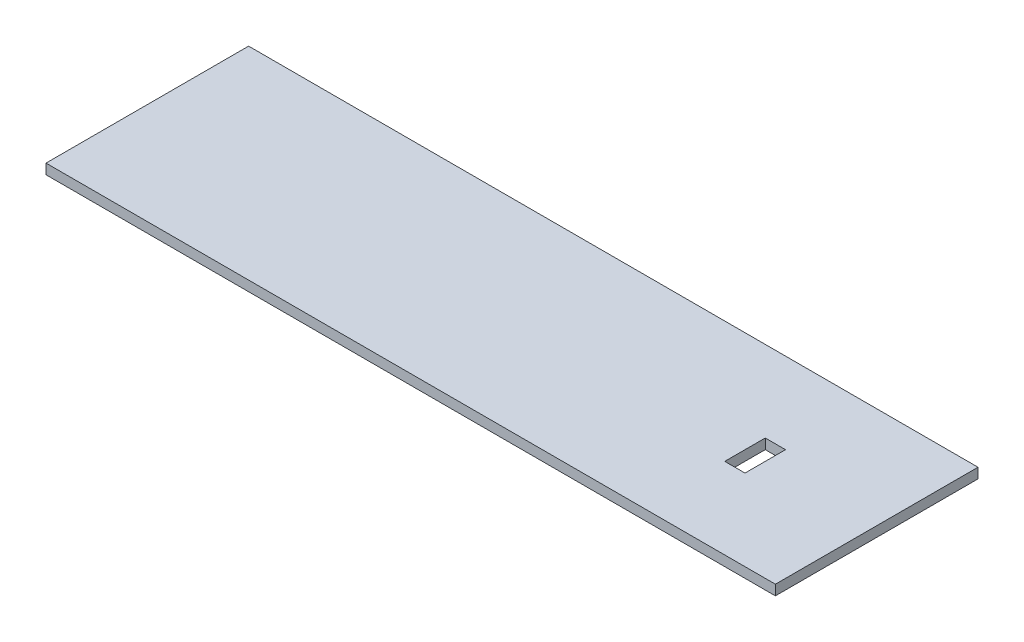
from build123d import *

# Parameters (mm, degrees)
CROQUIS1_W              = 720
CROQUIS1_H              = 200
SALIENTE_EXTRUIR1_DEPTH = 10
CROQUIS2_W              = 20
CROQUIS2_H              = 40
CORTAR_EXTRUIR1_DEPTH   = 10


with BuildPart() as part:
    # Croquis1 → Saliente-Extruir1 (new body)
    with BuildSketch(Plane(origin=(0, 0, 0), x_dir=(1, 0, 0), z_dir=(0, 1, 0))):
        Rectangle(CROQUIS1_W, CROQUIS1_H)
    extrude(amount=SALIENTE_EXTRUIR1_DEPTH)

    # Croquis2 → Cortar-Extruir1 (cut)
    with BuildSketch(Plane(origin=(0, 0, 0), x_dir=(-1, 0, 0), z_dir=(0, -1, 0))):
        with Locations((-240, 0)):
            Rectangle(CROQUIS2_W, CROQUIS2_H)
    extrude(amount=-CORTAR_EXTRUIR1_DEPTH, mode=Mode.SUBTRACT)


solid = part.part
